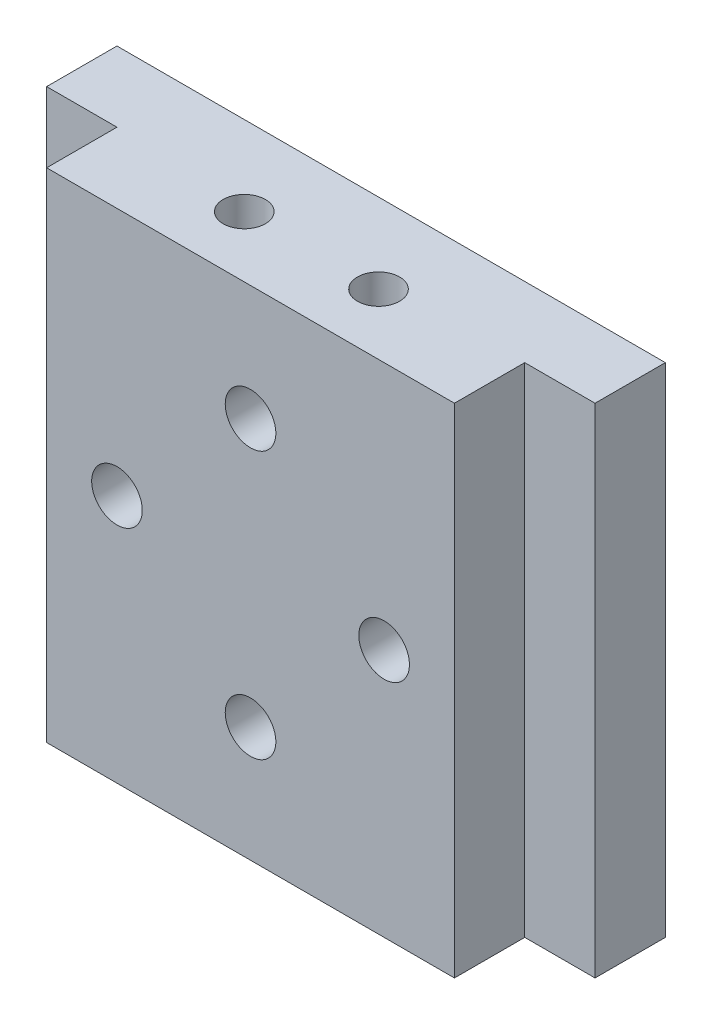
from build123d import *

# Parameters (mm, degrees)
BOSS_EXTRUDE1_DEPTH                             = 17.7
CSK_FOR_M3_FLAT_HEAD_MACHINE_SCREW1_D           = 3.6
CSK_FOR_M3_FLAT_HEAD_MACHINE_SCREW1_CSINK_D     = 6.3
CSK_FOR_M3_FLAT_HEAD_MACHINE_SCREW1_CSINK_ANGLE = 90
F_3_0MM_PRESS_DOWEL_HOLE1_D                     = 3


with BuildPart() as part:
    # Sketch1 → Boss-Extrude1 (new, symmetric)
    with BuildSketch(Plane(origin=(0, 0, 0), x_dir=(1, 0, 0), z_dir=(0, 1, 0))):
        Polygon((-14.5, 0), (14.5, 0), (14.5, 5), (19.5, 5), (19.5, 10), (-19.5, 10), (-19.5, 5), (-14.5, 5), align=None)
    extrude(amount=BOSS_EXTRUDE1_DEPTH, both=True)

    # CSK for M3 Flat Head Machine Screw1 (through all)
    with Locations(Plane(origin=(0, 0, -10), x_dir=(-1, 0, 0), z_dir=(0, 0, -1))):
        with Locations((0, 9.5), (-9.5, 0), (9.5, 0), (0, -9.5)):
            CounterSinkHole(CSK_FOR_M3_FLAT_HEAD_MACHINE_SCREW1_D / 2, CSK_FOR_M3_FLAT_HEAD_MACHINE_SCREW1_CSINK_D / 2, counter_sink_angle=CSK_FOR_M3_FLAT_HEAD_MACHINE_SCREW1_CSINK_ANGLE)

    # Ø3.0mm Press Dowel Hole1 (through all)
    with Locations(Plane(origin=(-4.77392109, 17.7, -4.32762779), x_dir=(0, 0, 1), z_dir=(0, 1, 0))):
        with Locations((0, 0), (0, 9.54784218)):
            Hole(F_3_0MM_PRESS_DOWEL_HOLE1_D / 2)


solid = part.part
